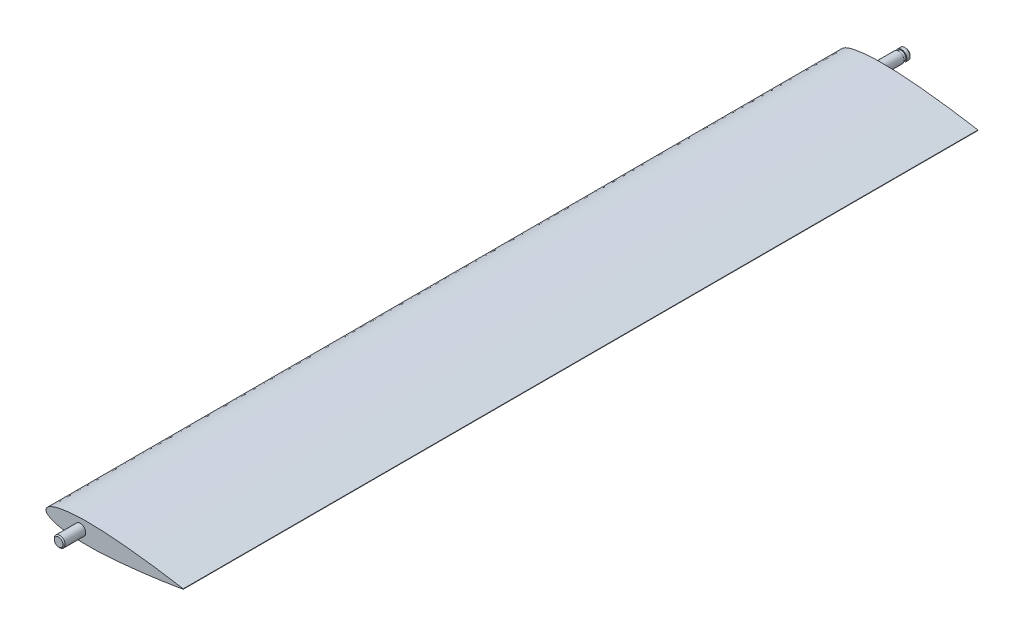
from build123d import *

# Parameters (mm, degrees)
BOSS_EXTRUDE1_DEPTH = 220
CUT_EXTRUDE4_START  = 5
CUT_EXTRUDE4_DEPTH  = 220
SKETCH7_R           = 1.5
BOSS_EXTRUDE3_DEPTH = 6
CHAMFER1_SIZE       = 0.3
BOSS_EXTRUDE4_DEPTH = 10
BOSS_EXTRUDE5_START = 8.5
SKETCH8_R           = 1.5
BOSS_EXTRUDE5_DEPTH = 8.5
SKETCH9_W           = 3.208728651
SKETCH9_H           = 0.658200749
CUT_EXTRUDE5_DEPTH  = 5.7
SKETCH10_W          = 0.8
SKETCH10_H          = 0.8
CHAMFER2_SIZE       = 0.3


with BuildPart() as part:
    # 3DSketch1 → Boss-Extrude1 (new body)
    with BuildSketch(Plane(origin=(38, 0.05985, 0), x_dir=(-0.9999987605662982, -0.0015744414461987257, 0), z_dir=(0, 0, 1))):
        with BuildLine():
            Line((0, 0), (0.000188461, 0.119699852))
            add(Edge.make_bspline(
                [(0, 0), (0.013008969, -0.002301665), (0.064987996, -0.011498265), (0.878918073, -0.155109339), (2.122747351, -0.366158609), (3.854708335, -0.64423331), (5.115099042, -0.837864444), (6.241949789, -1.004709724), (7.167863067, -1.138091002), (8.142385133, -1.274400759), (9.161511532, -1.412504699), (10.221055455, -1.551245985), (11.316663463, -1.689441985), (12.443834406, -1.825876781), (13.597937358, -1.95929579), (14.774232361, -2.088393861), (15.967887624, -2.211832712), (17.174001845, -2.328218569), (18.38762198, -2.43613523), (19.603765591, -2.534135408), (20.817440615, -2.620776748), (22.023665083, -2.694633015), (23.217488253, -2.754324117), (24.394010116, -2.798554482), (25.548402467, -2.826137225), (26.675927863, -2.836026975), (27.771958945, -2.827361992), (28.831998439, -2.799478733), (29.851697596, -2.751943983), (30.826875272, -2.684563052), (31.753535953, -2.597399236), (32.627887979, -2.49075866), (33.446362422, -2.365189641), (34.205632559, -2.221460498), (34.902633245, -2.060521235), (35.534585719, -1.883474011), (36.099025947, -1.691512743), (36.593837882, -1.485848884), (37.01729848, -1.267612615), (37.368098982, -1.037662977), (37.645244109, -0.796280496), (37.847528312, -0.542837587), (37.972024421, -0.276065099), (38.013481, 0), (37.972893923, 0.276194273), (37.849238465, 0.543357461), (37.647753325, 0.797436081), (37.371369657, 1.039690062), (37.021294977, 1.270743188), (36.598523679, 1.490311802), (36.104361807, 1.697532744), (35.540528841, 1.891270415), (34.909136999, 2.070306703), (34.212646547, 2.233439939), (33.453832761, 2.379559219), (32.635757777, 2.507704892), (31.761745884, 2.617098168), (30.835364265, 2.707179494), (29.860403599, 2.777630808), (28.840859178, 2.828376231), (27.78091274, 2.859597288), (26.684914377, 2.871713498), (25.557363429, 2.865374238), (24.402889947, 2.841426673), (23.226234641, 2.800901253), (22.03222943, 2.744969652), (20.825778377, 2.674912005), (19.611836547, 2.59209281), (18.395390375, 2.497922608), (17.18143644, 2.393828024), (15.974961714, 2.281240652), (14.780923674, 2.161561089), (13.604227989, 2.036167669), (12.449710638, 1.906383452), (11.322115667, 1.773498657), (10.226077928, 1.638753279), (9.166102378, 1.503349057), (8.14654616, 1.368454907), (7.171599702, 1.235214478), (5.971956559, 1.066255579), (4.61222699, 0.866828491), (3.163831824, 0.64382584), (1.859829898, 0.434588056), (0.95126956, 0.283035586), (0.376186701, 0.18468592), (0.182027936, 0.151225462), (0.065212341, 0.13099342), (0.013204613, 0.121960541), (0.000188461, 0.119699852)],
                knots=[0, 0, 0, 0, 0.000507191, 0.002026549, 0.031730705, 0.048941396, 0.069370417, 0.0806864, 0.092674465, 0.105284498, 0.118463914, 0.132157787, 0.146309137, 0.160859124, 0.17574728, 0.190911793, 0.206289795, 0.221817607, 0.23743107, 0.253065906, 0.268657997, 0.284143789, 0.29946058, 0.31454691, 0.329342915, 0.343790609, 0.357834202, 0.371420409, 0.384498713, 0.397021579, 0.408944786, 0.420227626, 0.430833276, 0.440729268, 0.449888045, 0.458287938, 0.465914574, 0.472763112, 0.478841878, 0.484178391, 0.488829227, 0.492895252, 0.496540366, 0.5, 0.503459634, 0.507104748, 0.511170773, 0.515821609, 0.521158122, 0.527236888, 0.534085426, 0.541712062, 0.550111955, 0.559270732, 0.569166724, 0.579772374, 0.591055214, 0.602978421, 0.615501287, 0.628579591, 0.642165798, 0.656209391, 0.670657085, 0.68545309, 0.70053942, 0.715856211, 0.731342003, 0.746934094, 0.76256893, 0.778182393, 0.793710205, 0.809088207, 0.82425272, 0.839140876, 0.853690863, 0.867842213, 0.881536086, 0.894715502, 0.907325535, 0.9193136, 0.941226079, 0.960085727, 0.975574601, 0.991928874, 0.995448502, 0.997973451, 0.999492809, 1, 1, 1, 1], degree=3))
        make_face()
    extrude(amount=BOSS_EXTRUDE1_DEPTH)

    # Sketch5 → Cut-Extrude4 (cut)
    with BuildSketch(Plane(origin=(0, 0, 0), x_dir=(-1, 0, 0), z_dir=(0, 0, -1)).offset(CUT_EXTRUDE4_START)):
        with BuildLine():
            Line((-32.712631, 0.105151), (-32.712631, -0.105151))
            add(Edge.make_bspline(
                [(-0.837107, -0.107562), (-0.845826584, -0.12116719), (-0.868620743, -0.156732975), (-0.912262573, -0.209113541), (-0.974864537, -0.274155604), (-1.049632752, -0.340523117), (-1.147976563, -0.417259366), (-1.256385762, -0.491877972), (-1.391077702, -0.574845049), (-1.532816156, -0.653199432), (-1.702806728, -0.738314449), (-1.876587374, -0.817243723), (-2.080301477, -0.901695942), (-2.301817557, -0.985549047), (-2.537895145, -1.066628844), (-2.790829072, -1.146401899), (-3.039688197, -1.218408436), (-3.322288337, -1.293574332), (-3.598002071, -1.360869976), (-3.908805822, -1.430536274), (-4.210039421, -1.492386934), (-4.547622538, -1.555857983), (-4.87306445, -1.611688556), (-5.236016767, -1.668415162), (-5.612382218, -1.721749075), (-5.999367246, -1.770714437), (-6.398957317, -1.816147096), (-6.780275546, -1.854802911), (-7.201565409, -1.892623105), (-7.60234547, -1.924127385), (-8.043844964, -1.954176907), (-8.630056621, -1.988119175), (-9.226718403, -2.013654564), (-10.011889679, -2.037361235), (-10.641130768, -2.04798446), (-11.462002386, -2.052117113), (-12.268766275, -2.047493557), (-13.274388828, -2.028093119), (-14.299188374, -1.99558325), (-15.18308063, -1.95747684), (-16.0782489, -1.911637636), (-16.981774535, -1.858374829), (-18.047060577, -1.785895703), (-19.11580735, -1.704284672), (-20.184508831, -1.614529003), (-21.288734495, -1.514057804), (-22.539288612, -1.391767691), (-23.776066228, -1.261527655), (-24.956087957, -1.129598955), (-26.140197163, -0.99133707), (-27.466946913, -0.8285652), (-28.884756189, -0.6451755), (-30.076728075, -0.483842629), (-30.934667374, -0.363725788), (-31.483337288, -0.285344283), (-31.894100694, -0.22591429), (-32.292869896, -0.167577194), (-32.574170638, -0.125742602), (-32.712631, -0.105151)],
                knots=[0, 0, 0, 0, 0.001497815, 0.003915487, 0.006305249, 0.009867805, 0.013175096, 0.017869751, 0.022064556, 0.027842692, 0.032883124, 0.039692737, 0.045538906, 0.053332861, 0.061655193, 0.06868527, 0.077927885, 0.085678959, 0.095804216, 0.104246626, 0.115217819, 0.124322282, 0.136102578, 0.145839435, 0.158391242, 0.171354968, 0.182014316, 0.195688362, 0.206899555, 0.221242399, 0.23297144, 0.247939614, 0.275699072, 0.288355547, 0.320791017, 0.334062197, 0.364485795, 0.395611616, 0.427341493, 0.459574384, 0.477660927, 0.510470072, 0.543514214, 0.576685752, 0.60987618, 0.642976635, 0.679516964, 0.726408334, 0.758311955, 0.789636752, 0.836971494, 0.882280021, 0.922222839, 0.948525668, 0.962623476, 0.97362451, 0.987017596, 1, 1, 1, 1], degree=3))
            Line((-0.837107, -0.107562), (-0.837107, 0.107562))
            add(Edge.make_bspline(
                [(-0.837107, 0.107562), (-0.845826584, 0.12116719), (-0.868620743, 0.156732975), (-0.912262573, 0.209113541), (-0.974864537, 0.274155604), (-1.049632752, 0.340523117), (-1.147976563, 0.417259366), (-1.256385762, 0.491877972), (-1.391077702, 0.574845049), (-1.532816156, 0.653199432), (-1.702806728, 0.738314449), (-1.876587374, 0.817243723), (-2.080301477, 0.901695942), (-2.301817557, 0.985549047), (-2.537895145, 1.066628844), (-2.790829072, 1.146401899), (-3.039688197, 1.218408436), (-3.322288337, 1.293574332), (-3.598002071, 1.360869976), (-3.908805822, 1.430536274), (-4.210039421, 1.492386934), (-4.547622538, 1.555857983), (-4.87306445, 1.611688556), (-5.236016767, 1.668415162), (-5.612382218, 1.721749075), (-5.999367246, 1.770714437), (-6.398957317, 1.816147096), (-6.780275546, 1.854802911), (-7.201565409, 1.892623105), (-7.60234547, 1.924127385), (-8.043844964, 1.954176907), (-8.630056621, 1.988119175), (-9.226718403, 2.013654564), (-10.011889679, 2.037361235), (-10.641130768, 2.04798446), (-11.462002386, 2.052117113), (-12.268766275, 2.047493557), (-13.274388828, 2.028093119), (-14.299188374, 1.99558325), (-15.18308063, 1.95747684), (-16.0782489, 1.911637636), (-16.981774535, 1.858374829), (-18.047060577, 1.785895703), (-19.11580735, 1.704284672), (-20.184508831, 1.614529003), (-21.288734495, 1.514057804), (-22.539288612, 1.391767691), (-23.776066228, 1.261527655), (-24.956087957, 1.129598955), (-26.140197163, 0.99133707), (-27.466946913, 0.8285652), (-28.884756189, 0.6451755), (-30.076728075, 0.483842629), (-30.934667374, 0.363725788), (-31.483337288, 0.285344283), (-31.894100694, 0.22591429), (-32.292869896, 0.167577194), (-32.574170638, 0.125742602), (-32.712631, 0.105151)],
                knots=[0, 0, 0, 0, 0.001497815, 0.003915487, 0.006305249, 0.009867805, 0.013175096, 0.017869751, 0.022064556, 0.027842692, 0.032883124, 0.039692737, 0.045538906, 0.053332861, 0.061655193, 0.06868527, 0.077927885, 0.085678959, 0.095804216, 0.104246626, 0.115217819, 0.124322282, 0.136102578, 0.145839435, 0.158391242, 0.171354968, 0.182014316, 0.195688362, 0.206899555, 0.221242399, 0.23297144, 0.247939614, 0.275699072, 0.288355547, 0.320791017, 0.334062197, 0.364485795, 0.395611616, 0.427341493, 0.459574384, 0.477660927, 0.510470072, 0.543514214, 0.576685752, 0.60987618, 0.642976635, 0.679516964, 0.726408334, 0.758311955, 0.789636752, 0.836971494, 0.882280021, 0.922222839, 0.948525668, 0.962623476, 0.97362451, 0.987017596, 1, 1, 1, 1], degree=3))
        make_face()
    extrude(amount=-CUT_EXTRUDE4_DEPTH, mode=Mode.SUBTRACT)

    # Sketch7 → Boss-Extrude3 (add)
    with BuildSketch(Plane.XY.offset(220)):
        with Locations((9.5, 0)):
            Circle(SKETCH7_R)
    extrude(amount=BOSS_EXTRUDE3_DEPTH)

    # Chamfer1
    chamfer1_edges = [part.edges().sort_by_distance(p)[0] for p in [
        (8, 0, 226),
    ]]
    chamfer(chamfer1_edges, length=CHAMFER1_SIZE)

    # 3DSketch2 → Boss-Extrude4 (add)
    with BuildSketch(Plane(origin=(38, 0.05985, 0), x_dir=(-0.9999987605662982, -0.0015744414461987257, 0), z_dir=(0, 0, 1))):
        with BuildLine():
            Line((0, 0), (0.000188461, 0.119699852))
            add(Edge.make_bspline(
                [(0, 0), (0.013008969, -0.002301665), (0.064987996, -0.011498265), (0.878918073, -0.155109339), (2.122747351, -0.366158609), (3.854708335, -0.64423331), (5.115099042, -0.837864444), (6.241949789, -1.004709724), (7.167863067, -1.138091002), (8.142385133, -1.274400759), (9.161511532, -1.412504699), (10.221055455, -1.551245985), (11.316663463, -1.689441985), (12.443834406, -1.825876781), (13.597937358, -1.95929579), (14.774232361, -2.088393861), (15.967887624, -2.211832712), (17.174001845, -2.328218569), (18.38762198, -2.43613523), (19.603765591, -2.534135408), (20.817440615, -2.620776748), (22.023665083, -2.694633015), (23.217488253, -2.754324117), (24.394010116, -2.798554482), (25.548402467, -2.826137225), (26.675927863, -2.836026975), (27.771958945, -2.827361992), (28.831998439, -2.799478733), (29.851697596, -2.751943983), (30.826875272, -2.684563052), (31.753535953, -2.597399236), (32.627887979, -2.49075866), (33.446362422, -2.365189641), (34.205632559, -2.221460498), (34.902633245, -2.060521235), (35.534585719, -1.883474011), (36.099025947, -1.691512743), (36.593837882, -1.485848884), (37.01729848, -1.267612615), (37.368098982, -1.037662977), (37.645244109, -0.796280496), (37.847528312, -0.542837587), (37.972024421, -0.276065099), (38.013481, 0), (37.972893923, 0.276194273), (37.849238465, 0.543357461), (37.647753325, 0.797436081), (37.371369657, 1.039690062), (37.021294977, 1.270743188), (36.598523679, 1.490311802), (36.104361807, 1.697532744), (35.540528841, 1.891270415), (34.909136999, 2.070306703), (34.212646547, 2.233439939), (33.453832761, 2.379559219), (32.635757777, 2.507704892), (31.761745884, 2.617098168), (30.835364265, 2.707179494), (29.860403599, 2.777630808), (28.840859178, 2.828376231), (27.78091274, 2.859597288), (26.684914377, 2.871713498), (25.557363429, 2.865374238), (24.402889947, 2.841426673), (23.226234641, 2.800901253), (22.03222943, 2.744969652), (20.825778377, 2.674912005), (19.611836547, 2.59209281), (18.395390375, 2.497922608), (17.18143644, 2.393828024), (15.974961714, 2.281240652), (14.780923674, 2.161561089), (13.604227989, 2.036167669), (12.449710638, 1.906383452), (11.322115667, 1.773498657), (10.226077928, 1.638753279), (9.166102378, 1.503349057), (8.14654616, 1.368454907), (7.171599702, 1.235214478), (5.971956559, 1.066255579), (4.61222699, 0.866828491), (3.163831824, 0.64382584), (1.859829898, 0.434588056), (0.95126956, 0.283035586), (0.376186701, 0.18468592), (0.182027936, 0.151225462), (0.065212341, 0.13099342), (0.013204613, 0.121960541), (0.000188461, 0.119699852)],
                knots=[0, 0, 0, 0, 0.000507191, 0.002026549, 0.031730705, 0.048941396, 0.069370417, 0.0806864, 0.092674465, 0.105284498, 0.118463914, 0.132157787, 0.146309137, 0.160859124, 0.17574728, 0.190911793, 0.206289795, 0.221817607, 0.23743107, 0.253065906, 0.268657997, 0.284143789, 0.29946058, 0.31454691, 0.329342915, 0.343790609, 0.357834202, 0.371420409, 0.384498713, 0.397021579, 0.408944786, 0.420227626, 0.430833276, 0.440729268, 0.449888045, 0.458287938, 0.465914574, 0.472763112, 0.478841878, 0.484178391, 0.488829227, 0.492895252, 0.496540366, 0.5, 0.503459634, 0.507104748, 0.511170773, 0.515821609, 0.521158122, 0.527236888, 0.534085426, 0.541712062, 0.550111955, 0.559270732, 0.569166724, 0.579772374, 0.591055214, 0.602978421, 0.615501287, 0.628579591, 0.642165798, 0.656209391, 0.670657085, 0.68545309, 0.70053942, 0.715856211, 0.731342003, 0.746934094, 0.76256893, 0.778182393, 0.793710205, 0.809088207, 0.82425272, 0.839140876, 0.853690863, 0.867842213, 0.881536086, 0.894715502, 0.907325535, 0.9193136, 0.941226079, 0.960085727, 0.975574601, 0.991928874, 0.995448502, 0.997973451, 0.999492809, 1, 1, 1, 1], degree=3))
        make_face()
    extrude(amount=BOSS_EXTRUDE4_DEPTH)

    # Sketch8 → Boss-Extrude5 (add)
    with BuildSketch(Plane(origin=(0, 0, 0), x_dir=(-1, 0, 0), z_dir=(0, 0, -1)).offset(BOSS_EXTRUDE5_START)):
        with Locations(Location((-9.5, 0, 0), (0, 0, 180))):
            Circle(SKETCH8_R)
    extrude(amount=-BOSS_EXTRUDE5_DEPTH)

    # Sketch9 → Cut-Extrude5 (cut)
    with BuildSketch(Plane(origin=(0, 0, -8.5), x_dir=(-1, 0, 0), z_dir=(0, 0, -1))):
        with Locations((-9.40827369, -1.329100375)):
            Rectangle(SKETCH9_W, SKETCH9_H)
    extrude(amount=-CUT_EXTRUDE5_DEPTH, mode=Mode.SUBTRACT)

    # Sketch10 → Cut-Revolve1 (revolve, cut)
    with BuildSketch(Plane(origin=(0, 0, 0), x_dir=(1, 0, 0), z_dir=(0, 1, 0)), mode=Mode.PRIVATE) as cut_revolve1_sk:
        with Locations((11.15, 6.9)):
            Rectangle(SKETCH10_W, SKETCH10_H)
    revolve(cut_revolve1_sk.sketch.rotate(Axis((9.5, 0, -8.5), (0, 0, 1)), 318.189685104), axis=Axis((9.5, 0, -8.5), (0, 0, 1)), mode=Mode.SUBTRACT)

    # Chamfer2
    chamfer2_edges = [part.edges().sort_by_distance(p)[0] for p in [
        (9.5, 1.5, -8.5),
    ]]
    chamfer(chamfer2_edges, length=CHAMFER2_SIZE)


solid = part.part
